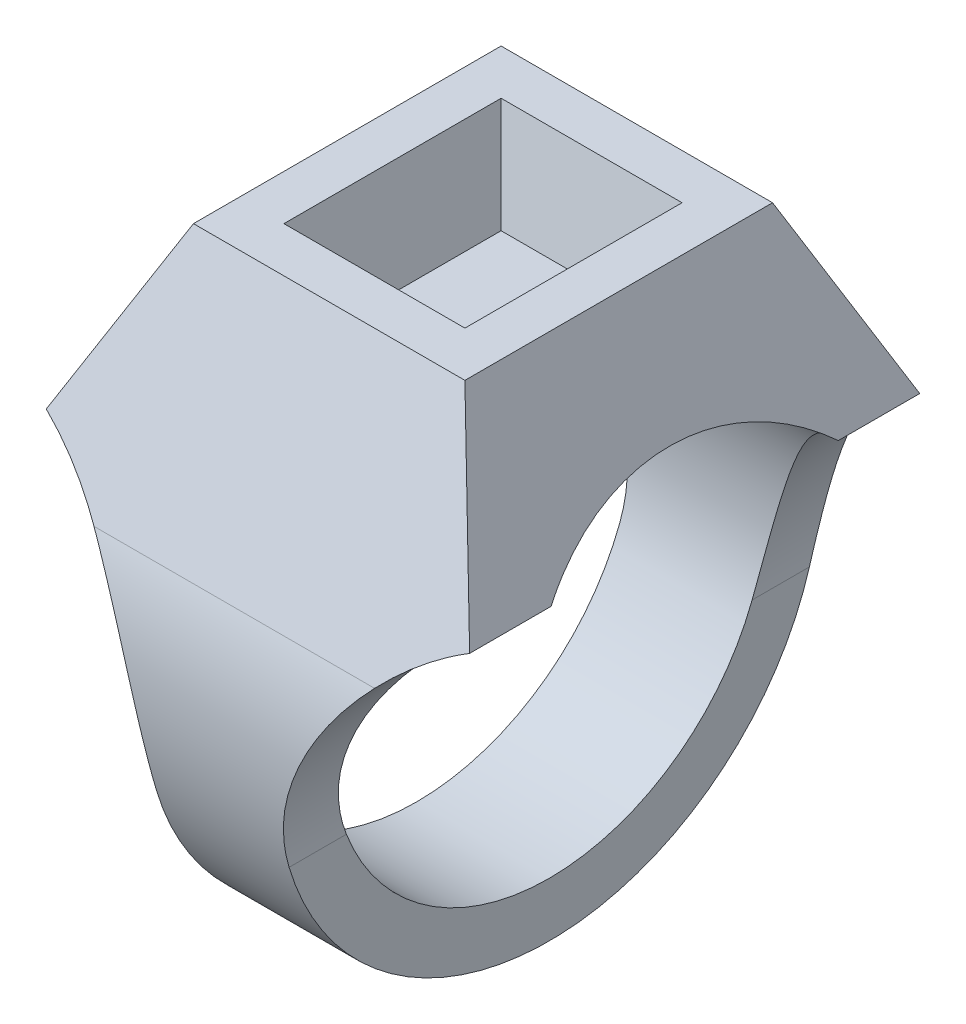
from build123d import *

# Parameters (mm, degrees)
SKETCH_2_R               = 12
EXTRUDE_1_DEPTH          = 25
SKETCH_3_W               = 10
SKETCH_3_H               = 12
CUT_EXTRUDE_1_DEPTH      = 5
CUT_EXTRUDE_1_DRAFT      = -15
CUT_EXTRUDE_2_DEPTH      = 35.263683398
CUT_EXTRUDE_2_DEPTH_BACK = 35.263683398
SKETCH_4_OUTSIDE_W       = 65.4
SKETCH_4_OUTSIDE_H       = 48.4


with BuildPart() as part:
    # 草图2 → 凸台-拉伸1 (new, symmetric)
    with BuildSketch(Plane(origin=(0, 0, 0), x_dir=(0, 0, -1), z_dir=(1, 0, 0))):
        with BuildLine():
            Line((-13.743313889, 6.010101774), (-8.5, 18))
            Line((-8.5, 18), (8.5, 18))
            Line((8.5, 18), (13.743313889, 6.010101774))
            ThreePointArc((13.743313889, 6.010101774), (0, -15), (-13.743313889, 6.010101774))
        make_face()
        Circle(SKETCH_2_R, mode=Mode.SUBTRACT)
    extrude(amount=EXTRUDE_1_DEPTH, both=True)


with BuildPart() as cut_extrude_1_tool:
    # 草图3 → 切除-拉伸1 (with draft: the straight prism first)
    with BuildSketch(Plane(origin=(0, 18, 0), x_dir=(1, 0, 0), z_dir=(0, 1, 0))):
        Rectangle(SKETCH_3_W, SKETCH_3_H)
    extrude(amount=-CUT_EXTRUDE_1_DEPTH)
    # 切除-拉伸1: the draft: its side faces are tilted about the plane it starts from
    cut_extrude_1_sides = [cut_extrude_1_tool.faces().sort_by_distance(p)[0] for p in [
        (-5, 15.5, 0),
        (0, 15.5, 6),
        (5, 15.5, 0),
        (0, 15.5, -6),
    ]]
    draft(cut_extrude_1_sides, Plane(origin=(0, 18, 0), x_dir=(1, 0, 0), z_dir=(0, 1, 0)), CUT_EXTRUDE_1_DRAFT)


with BuildPart() as part_1:
    add(part.part)

    # 切除-拉伸1: cut by cut_extrude_1_tool
    add(cut_extrude_1_tool.part, mode=Mode.SUBTRACT)

    # 草图4 outside → 切除-拉伸2 (cut, two sides: drawn at the far end of the back side and taken through both)
    with BuildSketch(Plane.XY.offset(-CUT_EXTRUDE_2_DEPTH_BACK)):
        with Locations((0, 1.5)):
            Rectangle(SKETCH_4_OUTSIDE_W, SKETCH_4_OUTSIDE_H)
        with BuildLine():
            Line((7.5, 18), (-7.5, 18))
            Line((-7.5, 18), (-11.696768923, 9))
            ThreePointArc((-11.696768923, 9), (-5.825685936, 3.477922356), (-3.660254038, -4.285701903))
            Line((-3.660254038, -4.285701903), (-3.660254038, -15))
            Line((-3.660254038, -15), (3.660254038, -15))
            Line((3.660254038, -15), (3.660254038, -4.285701903))
            ThreePointArc((3.660254038, -4.285701903), (5.825685936, 3.477922356), (11.696768923, 9))
            Line((11.696768923, 9), (7.5, 18))
        make_face(mode=Mode.SUBTRACT)
    extrude(amount=CUT_EXTRUDE_2_DEPTH + CUT_EXTRUDE_2_DEPTH_BACK, mode=Mode.SUBTRACT)


solid = part_1.part
